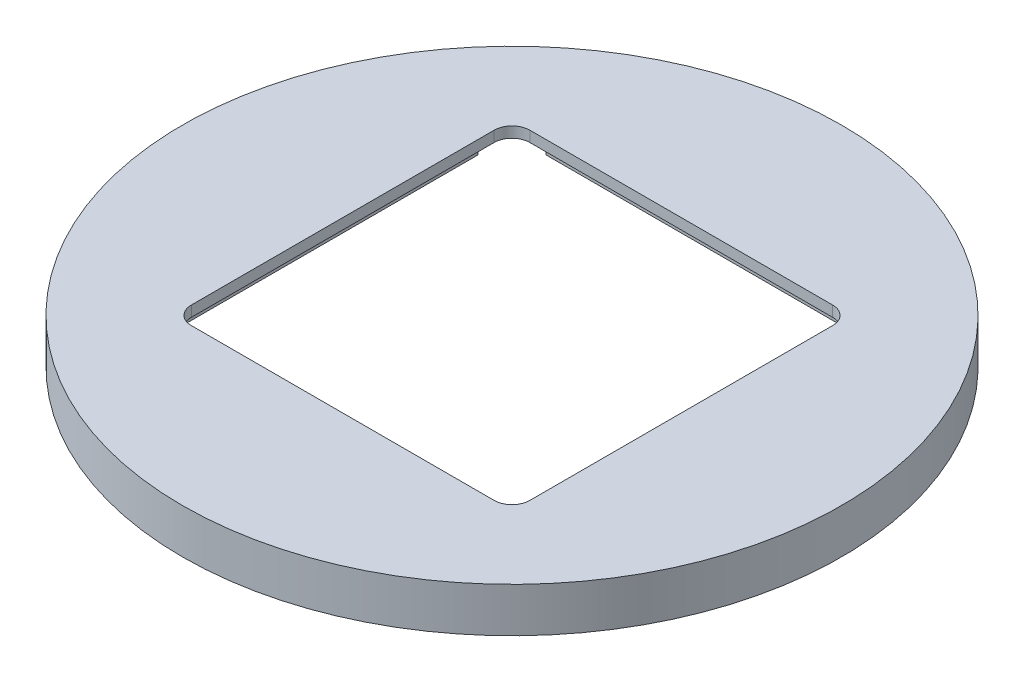
from build123d import *

# Parameters (mm, degrees)
SKETCH2_R           = 18.5
SKETCH2_W           = 22.5
SKETCH2_H           = 22.5
BOSS_EXTRUDE1_DEPTH = 2.5
SKETCH4_R           = 1.67
CUT_EXTRUDE1_DEPTH  = 1.15
CIRPATTERN1_COUNT   = 4
SKETCH5_W           = 22.5
SKETCH5_H           = 22.5
SKETCH5_W_2         = 19
SKETCH5_H_2         = 19
BOSS_EXTRUDE2_DEPTH = 0.6
FILLET1_R           = 1
SKETCH6_R           = 1.5
CUT_EXTRUDE2_DEPTH  = 1.9


with BuildPart() as part:
    # Sketch2 → Boss-Extrude1 (new body)
    with BuildSketch(Plane(origin=(0, 0, 0), x_dir=(1, 0, 0), z_dir=(0, 1, 0))):
        with Locations(Location((-21.383734207, -0.621346489, 0), (0, 0, 270))):
            Circle(SKETCH2_R)
        with Locations((-21.383734207, -0.621346489)):
            Rectangle(SKETCH2_W, SKETCH2_H, mode=Mode.SUBTRACT)
    extrude(amount=BOSS_EXTRUDE1_DEPTH)

    # Sketch4 → Cut-Extrude1 (cut)
    with BuildSketch(Plane.XZ):
        with Locations(Location((-21.569675845, 16.401346489, 0), (0, 0, 270))):
            Circle(SKETCH4_R)
    cut_extrude1 = extrude(amount=-CUT_EXTRUDE1_DEPTH, mode=Mode.SUBTRACT)

    # CirPattern1: Cut-Extrude1 ×4 about axis
    cirpattern1_axis = Axis((-21.383734207, 0, 0.621346489), (0, 1, 0))
    for i in range(1, CIRPATTERN1_COUNT):
        add(cut_extrude1.rotate(cirpattern1_axis, i * 360 / CIRPATTERN1_COUNT), mode=Mode.SUBTRACT)

    # Sketch5 → Boss-Extrude2 (add)
    with BuildSketch(Plane(origin=(0, 2.5, 0), x_dir=(1, 0, 0), z_dir=(0, 1, 0))):
        with Locations((-21.383734207, -0.621346489)):
            Rectangle(SKETCH5_W, SKETCH5_H)
        with Locations((-21.383734207, -0.621346489)):
            Rectangle(SKETCH5_W_2, SKETCH5_H_2, mode=Mode.SUBTRACT)
    extrude(amount=-BOSS_EXTRUDE2_DEPTH)

    # Fillet1
    fillet1_edges = [part.edges().sort_by_distance(p)[0] for p in [
        (-30.883734207, 2.2, -8.878653511),
        (-30.883734207, 2.2, 10.121346489),
        (-11.883734207, 2.2, 10.121346489),
        (-11.883734207, 2.2, -8.878653511),
    ]]
    fillet(fillet1_edges, radius=FILLET1_R)

    # Sketch6 → Cut-Extrude2 (cut)
    with BuildSketch(Plane(origin=(0, 0, 0), x_dir=(-1, 0, 0), z_dir=(0, -1, 0))):
        with Locations((32.133734207, -11.371346489)):
            Circle(SKETCH6_R)
        with Locations((10.633734207, -11.371346489)):
            Circle(SKETCH6_R)
        with Locations((10.633734207, 10.128653511)):
            Circle(SKETCH6_R)
        with Locations((32.133734207, 10.128653511)):
            Circle(SKETCH6_R)
    extrude(amount=-CUT_EXTRUDE2_DEPTH, mode=Mode.SUBTRACT)


solid = part.part
